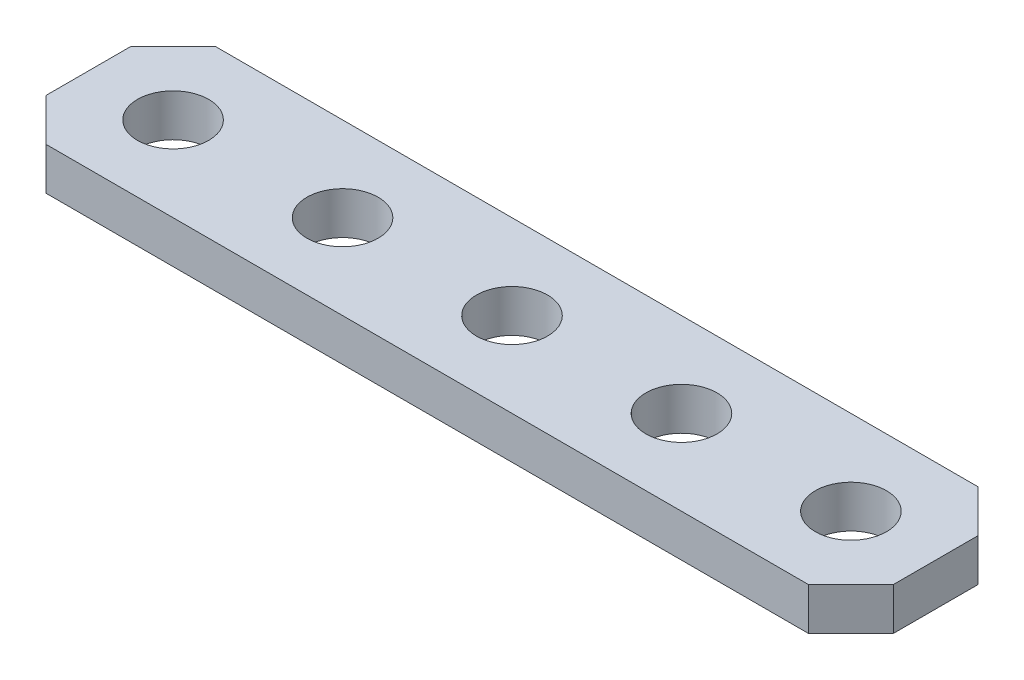
from build123d import *

# Parameters (mm, degrees)
SKETCH1_W           = 63.5
SKETCH1_H           = 12.7
SKETCH1_R           = 2.667
BOSS_EXTRUDE1_DEPTH = 3.175
CHAMFER1_SIZE       = 3.175


with BuildPart() as part:
    # Sketch1 → Boss-Extrude1 (new body)
    with BuildSketch(Plane(origin=(0, 0, 0), x_dir=(1, 0, 0), z_dir=(0, 1, 0))):
        with Locations((31.75, 6.35)):
            Rectangle(SKETCH1_W, SKETCH1_H)
        with Locations(Location((19.05, 6.35, 0), (0, 0, 270))):
            Circle(SKETCH1_R, mode=Mode.SUBTRACT)
        with Locations(Location((6.35, 6.35, 0), (0, 0, 270))):
            Circle(SKETCH1_R, mode=Mode.SUBTRACT)
        with Locations(Location((57.15, 6.35, 0), (0, 0, 270))):
            Circle(SKETCH1_R, mode=Mode.SUBTRACT)
        with Locations(Location((44.45, 6.35, 0), (0, 0, 270))):
            Circle(SKETCH1_R, mode=Mode.SUBTRACT)
        with Locations(Location((31.75, 6.35, 0), (0, 0, 270))):
            Circle(SKETCH1_R, mode=Mode.SUBTRACT)
    extrude(amount=BOSS_EXTRUDE1_DEPTH)

    # Chamfer1
    chamfer1_edges = [part.edges().sort_by_distance(p)[0] for p in [
        (0, 1.5875, 0),
        (0, 1.5875, -12.7),
        (63.5, 1.5875, -12.7),
        (63.5, 1.5875, 0),
    ]]
    chamfer(chamfer1_edges, length=CHAMFER1_SIZE)


solid = part.part
